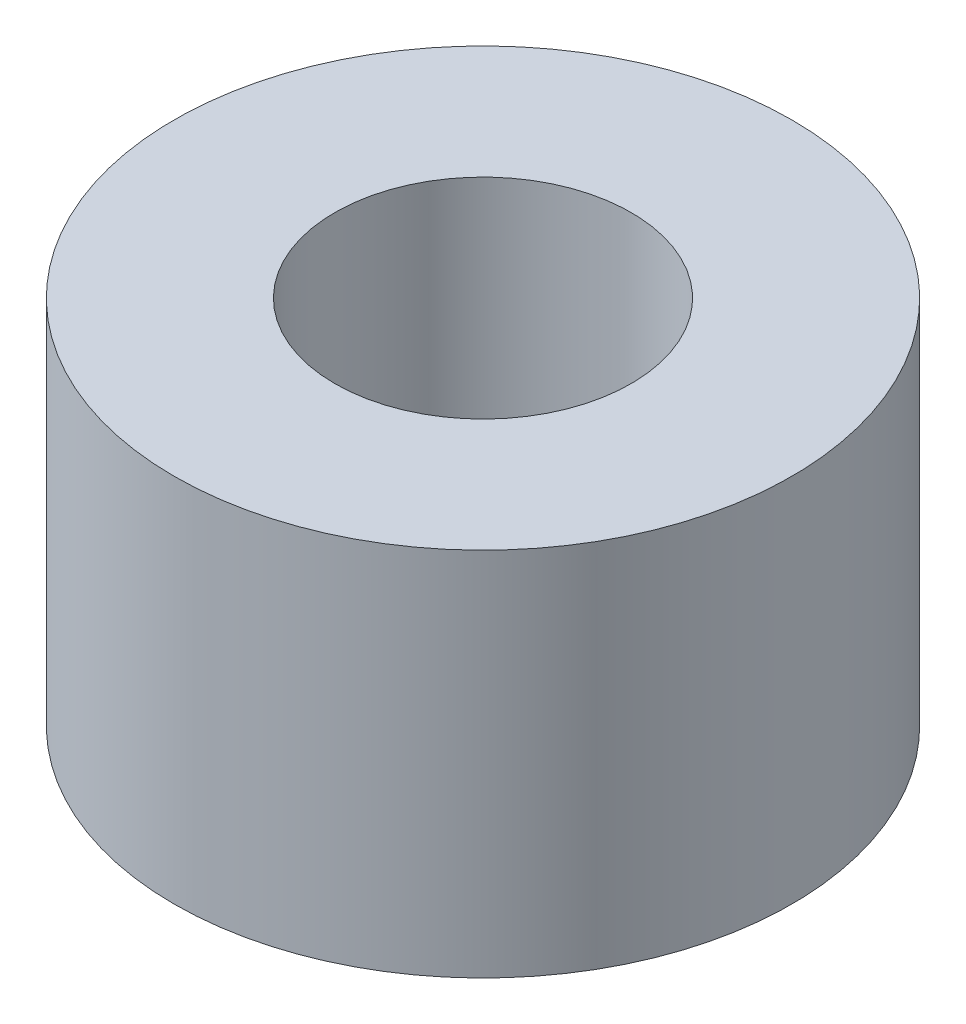
from build123d import *


with BuildPart() as part:
    # Sketch1 → Revolve1 (revolve)
    with BuildSketch(Plane(origin=(0, 0, 0), x_dir=(0, 0, -1), z_dir=(1, 0, 0))):
        Polygon((-60, 25.172413793), (-60, -109.827586207), (0, -109.827586207), (0, -124.827586207), (-125, -124.827586207), (-125, 25.172413793), align=None)
    revolve(axis=Axis((0, 120, 0), (0, -1, 0)))


solid = part.part
